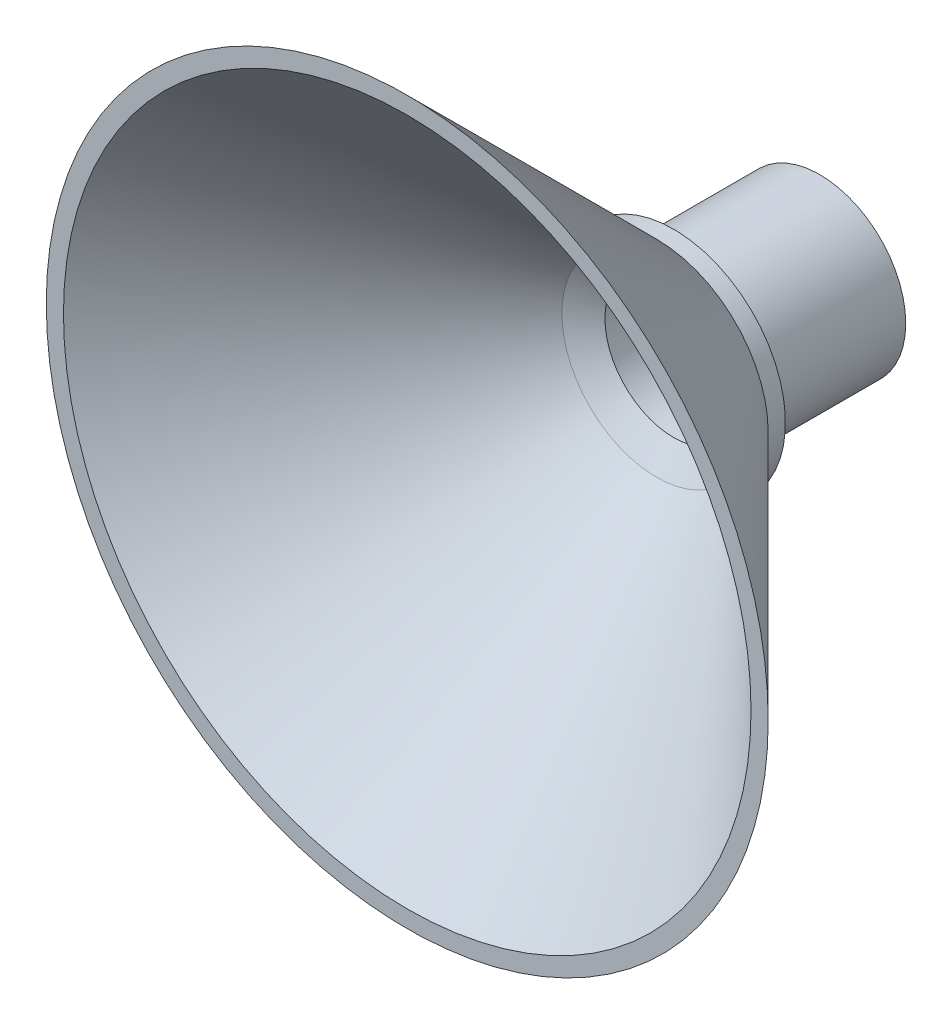
from build123d import *

# Parameters (mm, degrees)
SKETCH1_R           = 10
SKETCH1_R_2         = 8
BOSS_EXTRUDE1_DEPTH = 17


with BuildPart() as part:
    # Sketch1 → Boss-Extrude1 (new body)
    with BuildSketch(Plane.XY):
        Circle(SKETCH1_R)
        Circle(SKETCH1_R_2, mode=Mode.SUBTRACT)
    extrude(amount=BOSS_EXTRUDE1_DEPTH)

    # Sketch3 → Revolve1 (revolve)
    with BuildSketch(Plane(origin=(0, 0, 0), x_dir=(1, 0, 0), z_dir=(0, 1, 0))):
        Polygon((-10, -17), (-13, -17), (-13, -19), (-11, -19), (-8, -17), align=None)
    revolve(axis=Axis((0, 0, 0), (0, 0, 1)))

    # Sketch5 → Revolve2 (revolve)
    with BuildSketch(Plane(origin=(0, 0, 0), x_dir=(1, 0, 0), z_dir=(0, 1, 0)), mode=Mode.PRIVATE) as revolve2_sk:
        Polygon((-13, -19), (-42, -48), (-40, -48), (-11, -19), align=None)
    revolve(revolve2_sk.sketch.rotate(Axis((0, 0, 0), (0, 0, 1)), 180), axis=Axis((0, 0, 0), (0, 0, 1)))


solid = part.part
